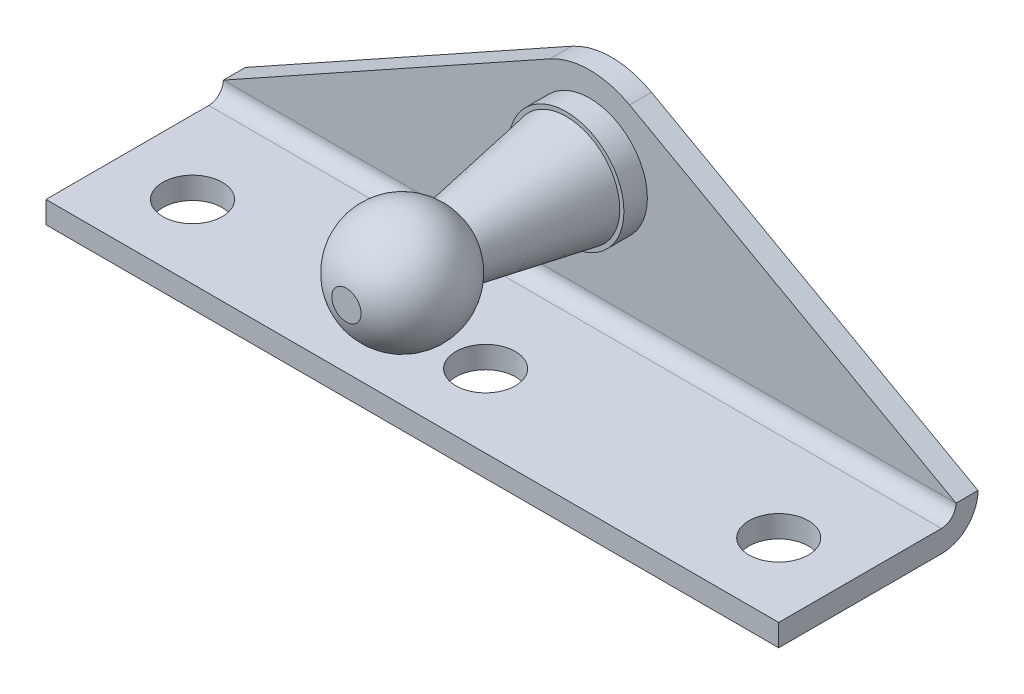
from build123d import *

# Parameters (mm, degrees)
EXTRUDE1_DEPTH     = 1.905
SKETCH4_W          = 63.5
SKETCH4_H          = 17.272
EXTRUDE2_DEPTH     = 1.905
FILLET1_R          = 1.27
FILLET2_R          = 3.175
SKETCH5_R          = 2.5781
CUT_EXTRUDE1_DEPTH = 42.217712552


with BuildPart() as part:
    # Sketch1 → Extrude1 (new body)
    with BuildSketch(Plane.XY):
        with BuildLine():
            Line((-31.75, -12.7), (31.75, -12.7))
            Line((31.75, -12.7), (31.75, -9.525))
            Line((31.75, -9.525), (3.457575677, 6.214958925))
            ThreePointArc((3.457575677, 6.214958925), (0, 7.112), (-3.457575677, 6.214958925))
            Line((-3.457575677, 6.214958925), (-31.75, -9.525))
            Line((-31.75, -9.525), (-31.75, -12.7))
        make_face()
    extrude(amount=EXTRUDE1_DEPTH)

    # Sketch4 → Extrude2 (add)
    with BuildSketch(Plane.XZ.offset(12.7)):
        with Locations((0, 8.636)):
            Rectangle(SKETCH4_W, SKETCH4_H)
    extrude(amount=-EXTRUDE2_DEPTH)

    # Fillet1
    fillet1_edges = [part.edges().sort_by_distance(p)[0] for p in [
        (0, -10.795, 1.905),
    ]]
    fillet(fillet1_edges, radius=FILLET1_R)

    # Fillet2
    fillet2_edges = [part.edges().sort_by_distance(p)[0] for p in [
        (0, -12.7, 0),
    ]]
    fillet(fillet2_edges, radius=FILLET2_R)

    # Sketch5 → Cut-Extrude1 (cut, through all)
    with BuildSketch(Plane.XZ.offset(12.7)):
        with Locations((-25.4, 10.922)):
            Circle(SKETCH5_R)
        with Locations((25.4, 10.922)):
            Circle(SKETCH5_R)
        with Locations((0, 10.922)):
            Circle(SKETCH5_R)
    extrude(amount=-CUT_EXTRUDE1_DEPTH, mode=Mode.SUBTRACT)

    # Sketch3 → Revolve1 (revolve)
    with BuildSketch(Plane.XZ):
        with BuildLine():
            Line((0, 1.905), (0, 22.987))
            Line((0, 22.987), (1.27, 22.987))
            ThreePointArc((1.27, 22.987), (4.92353173, 19.022090442), (2.852216719, 14.044294139))
            Line((2.852216719, 14.044294139), (4.640481928, 3.937))
            Line((4.640481928, 3.937), (5, 3.937))
            Line((5, 3.937), (5, 1.905))
            Line((5, 1.905), (0, 1.905))
        make_face()
    revolve(axis=Axis((0, 0, 1.905), (0, 0, -1)))


solid = part.part
